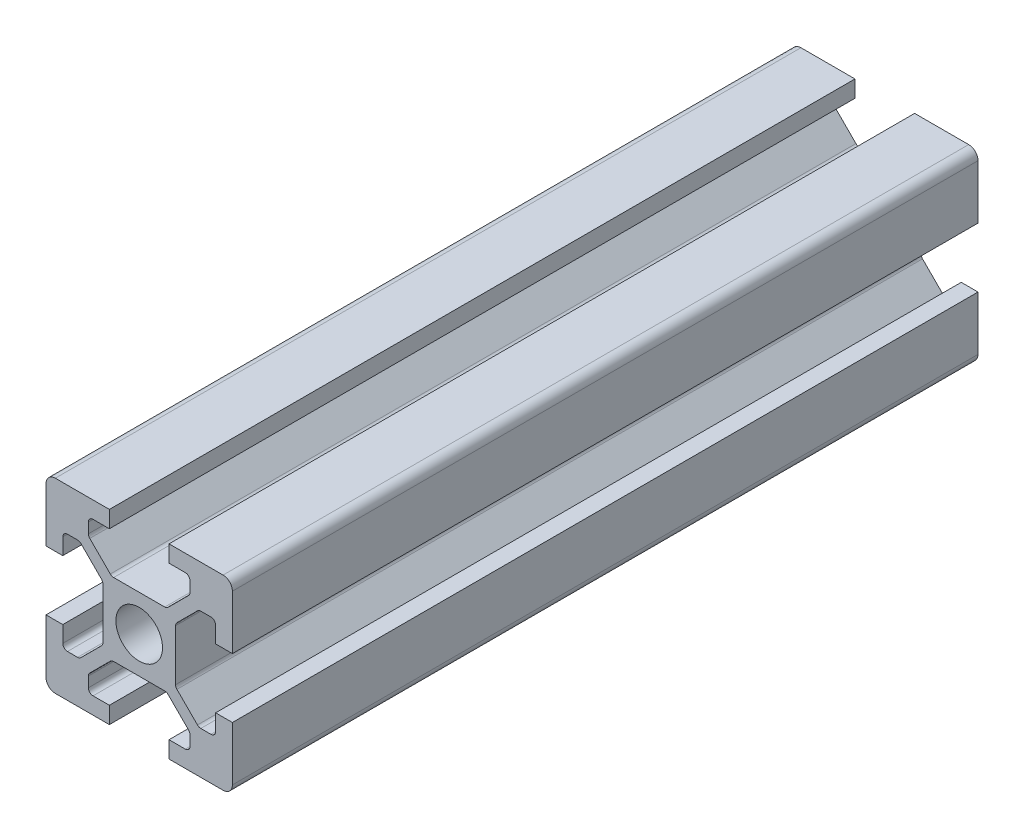
from build123d import *

# Parameters (mm, degrees)
SKETCH1_R               = 2.5
BOSS_EXTRUDE1_DEPTH     = 80
FILLET1_R               = 1
FILLET2_R               = 0.5
FILLET3_R               = 0.5
FILLET4_R               = 0.5
FILLET5_R               = 0.5
CUT_EXTRUDE1_DEPTH      = 85.852813742
CUT_EXTRUDE1_DEPTH_BACK = 85.852813742
SKETCH2_R               = 2.5


with BuildPart() as part:
    # Sketch1 → Boss-Extrude1 (new body)
    with BuildSketch(Plane.XY):
        Polygon((13.2, 0), (13.2, 1.8), (15.45, 1.8), (15.45, 3.6), (12.95, 6.1), (7.05, 6.1), (4.55, 3.6), (4.55, 1.8), (6.8, 1.8), (6.8, 0), (0, 0), (0, 6.8), (1.8, 6.8), (1.8, 4.55), (3.6, 4.55), (6.1, 7.05), (6.1, 12.95), (3.6, 15.45), (1.8, 15.45), (1.8, 13.2), (0, 13.2), (0, 20), (6.8, 20), (6.8, 18.2), (4.55, 18.2), (4.55, 16.4), (7.05, 13.9), (12.95, 13.9), (15.45, 16.4), (15.45, 18.2), (13.2, 18.2), (13.2, 20), (20, 20), (20, 13.2), (18.2, 13.2), (18.2, 15.45), (16.4, 15.45), (13.9, 12.95), (13.9, 7.05), (16.4, 4.55), (18.2, 4.55), (18.2, 6.8), (20, 6.8), (20, 0), align=None)
        with Locations((10, 10)):
            Circle(SKETCH1_R, mode=Mode.SUBTRACT)
    extrude(amount=BOSS_EXTRUDE1_DEPTH)

    # Fillet1
    fillet1_edges = [part.edges().sort_by_distance(p)[0] for p in [
        (0, 0, 40),
        (0, 20, 40),
        (20, 20, 40),
        (20, 0, 40),
    ]]
    fillet(fillet1_edges, radius=FILLET1_R)

    # Fillet2
    fillet2_edges = [part.edges().sort_by_distance(p)[0] for p in [
        (4.55, 18.2, 40),
        (4.55, 16.4, 40),
        (7.05, 13.9, 40),
        (12.95, 13.9, 40),
        (15.45, 16.4, 40),
        (15.45, 18.2, 40),
    ]]
    fillet(fillet2_edges, radius=FILLET2_R)

    # Fillet3
    fillet3_edges = [part.edges().sort_by_distance(p)[0] for p in [
        (18.2, 15.45, 40),
        (16.4, 15.45, 40),
        (13.9, 12.95, 40),
        (13.9, 7.05, 40),
        (16.4, 4.55, 40),
        (18.2, 4.55, 40),
    ]]
    fillet(fillet3_edges, radius=FILLET3_R)

    # Fillet4
    fillet4_edges = [part.edges().sort_by_distance(p)[0] for p in [
        (1.8, 4.55, 40),
        (3.6, 4.55, 40),
        (6.1, 7.05, 40),
        (6.1, 12.95, 40),
        (3.6, 15.45, 40),
        (1.8, 15.45, 40),
    ]]
    fillet(fillet4_edges, radius=FILLET4_R)

    # Fillet5
    fillet5_edges = [part.edges().sort_by_distance(p)[0] for p in [
        (15.45, 1.8, 40),
        (15.45, 3.6, 40),
        (12.95, 6.1, 40),
        (7.05, 6.1, 40),
        (4.55, 3.6, 40),
        (4.55, 1.8, 40),
    ]]
    fillet(fillet5_edges, radius=FILLET5_R)

    # Sketch2 → Cut-Extrude1 (cut, two sides: drawn at the far end of the back side and taken through both)
    with BuildSketch(Plane(origin=(0, 0, 0), x_dir=(0, 0, -1), z_dir=(1, 0, 0)).offset(-CUT_EXTRUDE1_DEPTH_BACK)):
        with Locations(Location((-65.9, 10, 0), (0, 0, 270))):
            Circle(SKETCH2_R)
        with Locations(Location((-14.1, 10, 0), (0, 0, 270))):
            Circle(SKETCH2_R)
    extrude(amount=CUT_EXTRUDE1_DEPTH + CUT_EXTRUDE1_DEPTH_BACK, mode=Mode.SUBTRACT)


solid = part.part
